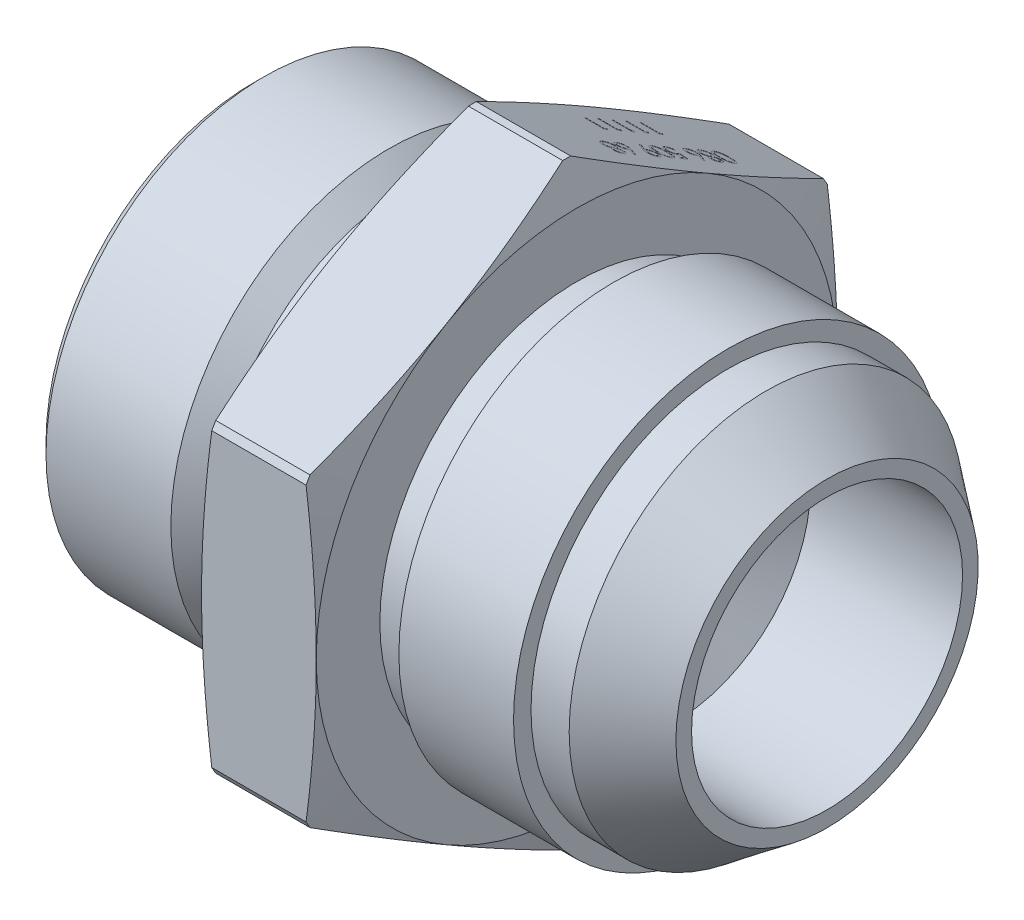
from build123d import *

# Parameters (mm, degrees)
SKETCH2_OUTSIDE_W  = 78.888
SKETCH2_OUTSIDE_H  = 78.888
EXTRUDE1_DEPTH     = 11
CUT_EXTRUDE1_DEPTH = 0.01


with BuildPart() as part:
    # Sketch1 → Revolve1 (revolve)
    with BuildSketch(Plane.XY, mode=Mode.PRIVATE) as revolve1_sk:
        with BuildLine():
            Line((0, 18.4), (0, 19.925))
            Line((0, 19.925), (1, 20.925))
            Line((1, 20.925), (12.975, 20.925))
            Line((12.975, 20.925), (15, 18.9))
            Line((15, 18.9), (19.2, 18.9))
            ThreePointArc((19.2, 18.9), (19.765685425, 19.134314575), (20, 19.7))
            Line((20, 19.7), (20, 25))
            Line((20, 25), (20.978014552, 28.65))
            Line((20.978014552, 28.65), (30.021985448, 28.65))
            Line((30.021985448, 28.65), (31, 25))
            Line((31, 25), (31, 18.9))
            Line((31, 18.9), (34.5, 18.9))
            Line((34.5, 18.9), (34.5, 20.575))
            Line((34.5, 20.575), (45.5, 20.575))
            Line((45.5, 20.575), (45.5, 18.9))
            Line((45.5, 18.9), (49.161002785, 18.9))
            Line((49.161002785, 18.9), (55, 14.5))
            Line((55, 14.5), (55, 13))
            Line((55, 13), (40.4, 13))
            Line((40.4, 13), (35.593115048, 5))
            Line((35.593115048, 5), (16.00860619, 5))
            Line((16.00860619, 5), (10, 15))
            Line((10, 15), (6, 15))
            Line((6, 15), (0, 18.4))
        make_face()
    revolve(revolve1_sk.sketch.rotate(Axis((0, 0, 0), (1, 0, 0)), 90), axis=Axis((0, 0, 0), (1, 0, 0)))

    # Sketch2 outside → Extrude1 (cut)
    with BuildSketch(Plane(origin=(31, 0, 0), x_dir=(0, 0, -1), z_dir=(1, 0, 0))):
        Rectangle(SKETCH2_OUTSIDE_W, SKETCH2_OUTSIDE_H)
        Polygon((25, -14.43375673), (25, 14.43375673), (0, 28.867513459), (-25, 14.43375673), (-25, -14.43375673), (0, -28.867513459), align=None, mode=Mode.SUBTRACT)
    extrude(amount=-EXTRUDE1_DEPTH, mode=Mode.SUBTRACT)

    # Sketch4 → Cut-Extrude1 (cut)
    # profile 1 of 13: a face of its own
    with BuildSketch(Plane(origin=(0, 21.650635095, -12.5), x_dir=(1, 0, 0), z_dir=(0, 0.8660254037844385, -0.5000000000000001))):
        with BuildLine():
            add(Edge.make_bspline(
                [(27.599198718, 6.492140653), (27.631254368, 6.491953214), (27.693522931, 6.491589111), (27.784257012, 6.487538585), (27.869377177, 6.480809818), (27.948887499, 6.471588461), (28.022808512, 6.460366763), (28.090942644, 6.445386468), (28.153605327, 6.428350637), (28.211000613, 6.408606196), (28.263902743, 6.386328099), (28.313286509, 6.362077694), (28.359089215, 6.334905811), (28.40199894, 6.306318976), (28.441536791, 6.27527255), (28.477627893, 6.242093996), (28.510294038, 6.206454196), (28.539924009, 6.169058024), (28.565735491, 6.129669148), (28.588993352, 6.089501794), (28.608082501, 6.047847177), (28.623767655, 6.0050852), (28.636335772, 5.96134022), (28.645039168, 5.916431486), (28.650493858, 5.870348149), (28.651016827, 5.839244821), (28.651282051, 5.823470781)],
                knots=[0, 0, 0, 0, 1.646377244, 3.198111528, 4.663803227, 6.031090796, 7.308794487, 8.502186765, 9.612154809, 10.642545331, 11.617106989, 12.558866172, 13.465886467, 14.35053239, 15.20542558, 16.045215227, 16.865619885, 17.686225247, 18.492864914, 19.282407821, 20.068097601, 20.842842034, 21.620163247, 22.403093475, 23.190129512, 24, 24, 24, 24], degree=3))
            add(Edge.make_bspline(
                [(28.651282051, 5.823470781), (28.6510033, 5.807564794), (28.650448951, 5.775932789), (28.645120984, 5.72916686), (28.636280342, 5.683481328), (28.623754071, 5.639070963), (28.608213684, 5.59557097), (28.588735331, 5.553321594), (28.566061693, 5.512060405), (28.539419477, 5.472443098), (28.509715319, 5.434034746), (28.476136651, 5.397778767), (28.439022526, 5.363671861), (28.398770032, 5.331285972), (28.354607127, 5.301539917), (28.307301921, 5.273212241), (28.256027141, 5.247856792), (28.201638303, 5.223436978), (28.142630498, 5.2023587), (28.079336349, 5.183349417), (28.011008242, 5.167990006), (27.938004673, 5.155196136), (27.86005754, 5.145284767), (27.777333931, 5.138066114), (27.689779422, 5.134252923), (27.629917794, 5.133534808), (27.599198718, 5.133166294)],
                knots=[0, 0, 0, 0, 0.810914788, 1.612654377, 2.396697861, 3.181598691, 3.963628158, 4.749916497, 5.551656086, 6.361998678, 7.18212741, 8.025565596, 8.878627764, 9.750805457, 10.657531673, 11.591944965, 12.560506719, 13.57287815, 14.630710178, 15.753379473, 16.941251878, 18.199788006, 19.531962791, 20.947069417, 22.433333509, 24, 24, 24, 24], degree=3))
            add(Edge.make_bspline(
                [(27.599198718, 5.133166294), (27.568613742, 5.133539088), (27.509020164, 5.134265463), (27.421858027, 5.138018366), (27.339578981, 5.145445635), (27.261953994, 5.154631994), (27.18944395, 5.167717836), (27.121359366, 5.182594133), (27.058287801, 5.201083773), (26.999591198, 5.221874753), (26.945468829, 5.245764682), (26.894637296, 5.271344226), (26.847370689, 5.299498021), (26.803208426, 5.329421475), (26.762606838, 5.361532087), (26.725465582, 5.395783416), (26.691809154, 5.432201532), (26.661699145, 5.470696721), (26.635367063, 5.510937264), (26.611830418, 5.552060729), (26.592731889, 5.594887903), (26.576606632, 5.638466986), (26.564051543, 5.683209176), (26.555455159, 5.729070587), (26.549409477, 5.775901024), (26.548949256, 5.807559291), (26.548717949, 5.823470781)],
                knots=[0, 0, 0, 0, 1.56130642, 3.042141888, 4.451772327, 5.777565838, 7.030558081, 8.211376819, 9.333164717, 10.383253789, 11.387583522, 12.350962576, 13.286244149, 14.193812918, 15.072134482, 15.925989337, 16.770211267, 17.600669898, 18.417446232, 19.22325363, 20.01647746, 20.807971184, 21.593601364, 22.38506573, 23.188331689, 24, 24, 24, 24], degree=3))
            add(Edge.make_bspline(
                [(26.548717949, 5.823470781), (26.548985725, 5.839244181), (26.549513727, 5.870346245), (26.554931552, 5.916438838), (26.5637662, 5.961277533), (26.575763607, 6.004951963), (26.591011601, 6.047551511), (26.610406484, 6.088658871), (26.632901531, 6.12881693), (26.658493856, 6.167842446), (26.687821995, 6.204991616), (26.720258045, 6.240477283), (26.756615569, 6.273403447), (26.796312609, 6.304060762), (26.839012336, 6.33315289), (26.885135373, 6.360058508), (26.934981836, 6.384261612), (26.988176002, 6.407038979), (27.045993115, 6.427117186), (27.108990015, 6.444718881), (27.177515185, 6.459392356), (27.251365196, 6.471192841), (27.330595321, 6.480921154), (27.415345059, 6.487506724), (27.505541292, 6.491592337), (27.56740988, 6.491954546), (27.599198718, 6.492140653)],
                knots=[0, 0, 0, 0, 0.810940842, 1.599017053, 2.38298203, 3.159479784, 3.926441347, 4.70693857, 5.494146311, 6.292334103, 7.104379492, 7.925868426, 8.762126819, 9.623561095, 10.503686106, 11.41783325, 12.366995289, 13.351843594, 14.392337808, 15.512229747, 16.713911458, 17.994391108, 19.357476964, 20.818259213, 22.365182633, 24, 24, 24, 24], degree=3))
        make_face()
        with BuildLine():
            add(Edge.make_bspline(
                [(27.6, 6.312653474), (27.573286458, 6.312585218), (27.521440718, 6.312452748), (27.446101712, 6.308992062), (27.375832952, 6.304277644), (27.310545218, 6.298196901), (27.250459492, 6.28916665), (27.195162546, 6.279048468), (27.14494693, 6.266735332), (27.099468354, 6.252166558), (27.057954011, 6.235573445), (27.019326804, 6.217453515), (26.983118411, 6.197998363), (26.949696589, 6.176187074), (26.918728647, 6.152514377), (26.89030358, 6.126941397), (26.864545412, 6.099513112), (26.833980849, 6.061543373), (26.802022844, 6.011663105), (26.77453652, 5.948493485), (26.757151332, 5.88355555), (26.754946603, 5.839467085), (26.753846154, 5.817461166)],
                knots=[0, 0, 0, 0, 1.459116078, 2.831857795, 4.118796693, 5.306371758, 6.412361096, 7.436813035, 8.376339383, 9.234574298, 10.043323891, 10.816788787, 11.564361537, 12.286735248, 12.994408768, 13.691741332, 14.372975427, 15.047457468, 16.352811911, 17.594285292, 18.799233213, 20, 20, 20, 20], degree=3))
            add(Edge.make_bspline(
                [(26.753846154, 5.817461166), (26.754759171, 5.795313925), (26.756583322, 5.751065169), (26.7741826, 5.686417286), (26.800736623, 5.623657132), (26.832135197, 5.574473166), (26.8620371, 5.53705457), (26.887531184, 5.510244861), (26.916077394, 5.485637976), (26.946876992, 5.462299648), (26.980518412, 5.440894462), (27.016839883, 5.421429811), (27.055942271, 5.403667899), (27.083239264, 5.393548444), (27.097195513, 5.388374628)],
                knots=[0, 0, 0, 0, 1.353760809, 2.704726607, 4.075137775, 5.516104923, 6.260822281, 7.007110065, 7.778089737, 8.566572457, 9.372053459, 10.217411131, 11.088608312, 12, 12, 12, 12], degree=3))
            add(Edge.make_bspline(
                [(27.097195513, 5.388374628), (27.115041078, 5.382345046), (27.151275229, 5.370102409), (27.20748303, 5.354324253), (27.266456038, 5.34189831), (27.327841819, 5.330719244), (27.392093077, 5.323088927), (27.459011011, 5.316947319), (27.528646075, 5.313329784), (27.575957498, 5.312881354), (27.6, 5.312653474)],
                knots=[0, 0, 0, 0, 0.884706709, 1.796334032, 2.740027952, 3.714592787, 4.726048262, 5.777819803, 6.87074269, 8, 8, 8, 8], degree=3))
            add(Edge.make_bspline(
                [(27.6, 5.312653474), (27.624041985, 5.312904802), (27.671079064, 5.313396514), (27.739894354, 5.316627107), (27.805368264, 5.321818402), (27.867560189, 5.328844706), (27.926359436, 5.338490335), (27.981850144, 5.350073775), (28.034017354, 5.36365403), (28.082995602, 5.379230987), (28.128608845, 5.396786002), (28.170956394, 5.41617903), (28.21026275, 5.436874018), (28.246415087, 5.459356091), (28.279576591, 5.483353425), (28.309082061, 5.509500647), (28.335846046, 5.536760275), (28.366396084, 5.574941528), (28.397545625, 5.624926835), (28.426211773, 5.687124348), (28.442673655, 5.751850431), (28.444994619, 5.79560669), (28.446153846, 5.817461166)],
                knots=[0, 0, 0, 0, 1.313668642, 2.570134578, 3.763346207, 4.902004944, 5.98888779, 7.017888835, 7.998425394, 8.933058446, 9.82474457, 10.667209444, 11.476765193, 12.250262638, 12.991704352, 13.7104269, 14.401925311, 15.076585796, 16.378385137, 17.609787933, 18.806186071, 20, 20, 20, 20], degree=3))
            add(Edge.make_bspline(
                [(28.446153846, 5.817461166), (28.444994515, 5.839582433), (28.442673741, 5.883865267), (28.426254941, 5.949250028), (28.397812513, 6.011890604), (28.366194931, 6.061474883), (28.336386868, 6.099607963), (28.310465662, 6.126535241), (28.281954605, 6.151709443), (28.251117774, 6.175401863), (28.217679095, 6.197192155), (28.181475967, 6.216655269), (28.142845171, 6.234764798), (28.101340273, 6.251393535), (28.055793136, 6.265827295), (28.005830952, 6.278728414), (27.950482357, 6.288840457), (27.890228647, 6.297664655), (27.824860654, 6.304392605), (27.754429892, 6.308979959), (27.678960601, 6.312459009), (27.626847358, 6.312587354), (27.6, 6.312653474)],
                knots=[0, 0, 0, 0, 1.207964612, 2.418129846, 3.655795183, 4.951004962, 5.620895151, 6.296795572, 6.989224116, 7.696855977, 8.419187164, 9.166715907, 9.940135271, 10.748837255, 11.607021648, 12.548275234, 13.5654991, 14.678641405, 15.874140913, 17.15372626, 18.533675393, 20, 20, 20, 20], degree=3))
        make_face(mode=Mode.SUBTRACT)
    # profile 2 of 13: a face of its own
    with BuildSketch(Plane(origin=(0, 21.650635095, -12.5), x_dir=(1, 0, 0), z_dir=(0, 0.8660254037844385, -0.5000000000000001))):
        with BuildLine():
            add(Edge.make_bspline(
                [(27.714182692, 3.981323346), (27.705636282, 3.965091147), (27.688915789, 3.933333912), (27.662079484, 3.887895332), (27.634045445, 3.84606079), (27.605693685, 3.80723409), (27.575903542, 3.772207165), (27.545015052, 3.740748242), (27.513855619, 3.711870371), (27.481206025, 3.687091769), (27.447739677, 3.665241603), (27.413168899, 3.646383667), (27.377602733, 3.630257922), (27.340644158, 3.617479533), (27.3028384, 3.606952677), (27.263696667, 3.599709506), (27.223477052, 3.595814116), (27.196295164, 3.595077652), (27.182532051, 3.594704756)],
                knots=[0, 0, 0, 0, 1.264385854, 2.473688339, 3.635349404, 4.734491366, 5.785876313, 6.801388178, 7.772322209, 8.711311751, 9.622826105, 10.524996139, 11.423212571, 12.31118177, 13.217849097, 14.126010572, 15.051135535, 16, 16, 16, 16], degree=3))
            add(Edge.make_bspline(
                [(27.182532051, 3.594704756), (27.163274882, 3.595141646), (27.125157718, 3.596006417), (27.068922021, 3.603663416), (27.014175758, 3.614838648), (26.961448205, 3.632240899), (26.910078621, 3.653026805), (26.861006258, 3.679766656), (26.81285893, 3.709774594), (26.783250853, 3.733926335), (26.768269231, 3.746147063)],
                knots=[0, 0, 0, 0, 1.02534174, 2.029536028, 3.018826961, 3.997522084, 4.983122576, 5.966563916, 6.971085759, 8, 8, 8, 8], degree=3))
            add(Edge.make_bspline(
                [(26.768269231, 3.746147063), (26.750787074, 3.76205362), (26.716038793, 3.793670172), (26.670924044, 3.847831845), (26.633010105, 3.907272921), (26.602111879, 3.971763397), (26.578062817, 4.041130884), (26.560781378, 4.115360601), (26.550882847, 4.194597259), (26.549451996, 4.249057529), (26.548717949, 4.276996422)],
                knots=[0, 0, 0, 0, 0.954267603, 1.896743057, 2.838368354, 3.796610408, 4.779680527, 5.799409237, 6.871065594, 8, 8, 8, 8], degree=3))
            add(Edge.make_bspline(
                [(26.548717949, 4.276996422), (26.549378275, 4.303860597), (26.550663202, 4.356135553), (26.559321404, 4.432234286), (26.574649728, 4.503256381), (26.595195854, 4.569538553), (26.622594577, 4.630439935), (26.656177494, 4.686071038), (26.695186057, 4.737248041), (26.740560382, 4.782362494), (26.789166236, 4.822412458), (26.839309667, 4.85759435), (26.890997388, 4.886836643), (26.943458147, 4.911594993), (26.997427384, 4.930548146), (27.05262739, 4.943675124), (27.108961757, 4.952011875), (27.146979845, 4.953121095), (27.166105769, 4.953679115)],
                knots=[0, 0, 0, 0, 1.256882982, 2.445766618, 3.576898315, 4.651879663, 5.686612882, 6.692806257, 7.686348993, 8.689277895, 9.678883454, 10.630458183, 11.551151498, 12.454054546, 13.341321255, 14.221808008, 15.105437234, 16, 16, 16, 16], degree=3))
            add(Edge.make_bspline(
                [(27.166105769, 4.953679115), (27.180139604, 4.953348913), (27.207875415, 4.952696318), (27.24885202, 4.948179031), (27.288736095, 4.940917907), (27.327671557, 4.931052203), (27.365387519, 4.917697604), (27.40201577, 4.901515531), (27.437837733, 4.882829703), (27.472237589, 4.860432693), (27.50636177, 4.835774674), (27.538543512, 4.806524659), (27.570575596, 4.77444425), (27.601071996, 4.738223642), (27.631498489, 4.698971458), (27.659918782, 4.655497995), (27.688412304, 4.609024658), (27.705445175, 4.575992521), (27.714182692, 4.559047704)],
                knots=[0, 0, 0, 0, 0.941717298, 1.86116577, 2.762973304, 3.660719123, 4.553575492, 5.444450535, 6.34648071, 7.261375261, 8.197060099, 9.168336537, 10.175980388, 11.237504102, 12.343496232, 13.506792996, 14.721035322, 16, 16, 16, 16], degree=3))
            add(Edge.make_bspline(
                [(27.714182692, 4.559047704), (27.726829161, 4.582245178), (27.751316264, 4.627161981), (27.79634113, 4.686597688), (27.844927465, 4.737732453), (27.898681063, 4.778584587), (27.955234414, 4.81100109), (28.014406292, 4.833892505), (28.07548817, 4.848840883), (28.117141606, 4.850354726), (28.138060897, 4.851115012)],
                knots=[0, 0, 0, 0, 1.16709546, 2.25982348, 3.287408737, 4.277418348, 5.234967981, 6.16072867, 7.076276605, 8, 8, 8, 8], degree=3))
            add(Edge.make_bspline(
                [(28.138060897, 4.851115012), (28.159373765, 4.850180466), (28.202216347, 4.848301865), (28.265991622, 4.833111675), (28.328628264, 4.808356233), (28.389831339, 4.774691517), (28.447495858, 4.732738893), (28.499388962, 4.682417141), (28.544452837, 4.624587296), (28.582524276, 4.56027613), (28.61366436, 4.491202728), (28.634921789, 4.418198326), (28.648903193, 4.342567538), (28.650481694, 4.291082143), (28.651282051, 4.264977192)],
                knots=[0, 0, 0, 0, 0.888753872, 1.786550278, 2.720173491, 3.693036334, 4.694165094, 5.687489879, 6.699912706, 7.744713188, 8.800178723, 9.852977058, 10.911381959, 12, 12, 12, 12], degree=3))
            add(Edge.make_bspline(
                [(28.651282051, 4.264977192), (28.65045911, 4.239545523), (28.648836362, 4.18939717), (28.635169495, 4.115573602), (28.612597078, 4.044880028), (28.581861931, 3.977702203), (28.543534279, 3.915507944), (28.498015789, 3.859978097), (28.446305023, 3.811268069), (28.388796676, 3.770797389), (28.327595084, 3.738137196), (28.263944305, 3.714878149), (28.198697276, 3.700083499), (28.154563796, 3.69820835), (28.132451923, 3.697268858)],
                knots=[0, 0, 0, 0, 1.072712831, 2.115267497, 3.156282165, 4.197922255, 5.225560591, 6.230883479, 7.219814004, 8.214446311, 9.19021444, 10.138875805, 11.067534608, 12, 12, 12, 12], degree=3))
            add(Edge.make_bspline(
                [(28.132451923, 3.697268858), (28.110750844, 3.698088489), (28.068131157, 3.699698198), (28.006003552, 3.713242701), (27.947812681, 3.73604404), (27.892939831, 3.767207341), (27.842144198, 3.807760661), (27.795594668, 3.857634528), (27.751440783, 3.91528115), (27.726879667, 3.958817197), (27.714182692, 3.981323346)],
                knots=[0, 0, 0, 0, 0.975287281, 1.915408787, 2.843441052, 3.776938647, 4.743139116, 5.754296123, 6.83907365, 8, 8, 8, 8], degree=3))
        make_face()
        with BuildLine():
            add(Edge.make_bspline(
                [(28.446153846, 4.274993217), (28.445781594, 4.289022249), (28.445053307, 4.31646917), (28.441248372, 4.356714125), (28.433846534, 4.394984049), (28.423995841, 4.431678792), (28.41068842, 4.466295256), (28.395034129, 4.499303573), (28.376002091, 4.530141967), (28.354652835, 4.559182712), (28.331171175, 4.585326012), (28.306706192, 4.608528613), (28.280777397, 4.627801821), (28.254029763, 4.644168169), (28.225669433, 4.656043322), (28.196565904, 4.66493721), (28.166351399, 4.670949434), (28.145701964, 4.671399942), (28.13525641, 4.671627833)],
                knots=[0, 0, 0, 0, 1.203892937, 2.355340988, 3.463153438, 4.544400666, 5.610487187, 6.640501085, 7.674077295, 8.714426146, 9.728707835, 10.68524104, 11.601827946, 12.495867327, 13.368432065, 14.231010473, 15.105153427, 16, 16, 16, 16], degree=3))
            add(Edge.make_bspline(
                [(28.13525641, 4.671627833), (28.124815111, 4.671221487), (28.104181604, 4.67041849), (28.073589551, 4.664606372), (28.043918206, 4.654888461), (28.014890581, 4.641563115), (27.986581183, 4.624462529), (27.958881533, 4.603707523), (27.932524126, 4.578397545), (27.906761151, 4.550447691), (27.883025341, 4.519917421), (27.861823216, 4.487835661), (27.844921069, 4.453968276), (27.83010134, 4.419329517), (27.818984825, 4.383186853), (27.810976031, 4.345789493), (27.806022092, 4.307177385), (27.805428525, 4.281017497), (27.805128205, 4.267781679)],
                knots=[0, 0, 0, 0, 0.873213166, 1.72559466, 2.594724523, 3.479581045, 4.391597569, 5.35687048, 6.368548091, 7.443976143, 8.534559525, 9.600545123, 10.654815915, 11.696401765, 12.749428718, 13.812189468, 14.893058657, 16, 16, 16, 16], degree=3))
            add(Edge.make_bspline(
                [(27.805128205, 4.267781679), (27.805626986, 4.25078162), (27.806619622, 4.216949409), (27.815848865, 4.167075506), (27.830366532, 4.118582566), (27.85022937, 4.071988906), (27.875159575, 4.028500572), (27.905007014, 3.989734819), (27.939082498, 3.956022308), (27.976855547, 3.927713388), (28.017056455, 3.905764905), (28.057399479, 3.888678157), (28.09831504, 3.87870032), (28.125724734, 3.877398853), (28.139262821, 3.876756038)],
                knots=[0, 0, 0, 0, 1.076279235, 2.141928126, 3.20205304, 4.278698113, 5.344010996, 6.36967002, 7.368914609, 8.37248503, 9.349703398, 10.264243087, 11.142681841, 12, 12, 12, 12], degree=3))
            add(Edge.make_bspline(
                [(28.139262821, 3.876756038), (28.148765014, 3.877059193), (28.167625505, 3.877660914), (28.19546926, 3.88264393), (28.222711979, 3.890814428), (28.249360263, 3.902084131), (28.275788837, 3.916045289), (28.300881979, 3.934080536), (28.326036181, 3.954553586), (28.350136692, 3.978336519), (28.372830255, 4.005147852), (28.392352555, 4.035410861), (28.409307358, 4.068355748), (28.422930774, 4.104251288), (28.433191336, 4.142957415), (28.440867002, 4.184326288), (28.445195137, 4.22869411), (28.445827345, 4.259225458), (28.446153846, 4.274993217)],
                knots=[0, 0, 0, 0, 0.814272661, 1.61621452, 2.416847352, 3.248328223, 4.093649164, 4.973549185, 5.892801723, 6.872536627, 7.872406081, 8.898230315, 9.953166191, 11.044090313, 12.18293744, 13.382234284, 14.648068262, 16, 16, 16, 16], degree=3))
        make_face(mode=Mode.SUBTRACT)
        with BuildLine():
            add(Edge.make_bspline(
                [(27.6, 4.263374628), (27.599683753, 4.281160854), (27.599063352, 4.316053092), (27.59215338, 4.367170435), (27.582542722, 4.416232667), (27.56793146, 4.463055048), (27.549089738, 4.507580176), (27.526037376, 4.549908351), (27.499195146, 4.590099468), (27.468416398, 4.627494992), (27.435082235, 4.66156621), (27.40024442, 4.691983253), (27.363652729, 4.717302021), (27.32563357, 4.737990749), (27.286234307, 4.754016879), (27.245462851, 4.765850395), (27.203197341, 4.772719578), (27.174543321, 4.773698413), (27.160096154, 4.774191935)],
                knots=[0, 0, 0, 0, 1.140506561, 2.237395584, 3.304560074, 4.345354409, 5.3782877, 6.402081073, 7.433555996, 8.474808822, 9.504965884, 10.489266388, 11.437701257, 12.354123303, 13.261162422, 14.161620169, 15.073101032, 16, 16, 16, 16], degree=3))
            add(Edge.make_bspline(
                [(27.160096154, 4.774191935), (27.142134486, 4.773415079), (27.106498958, 4.771873816), (27.053851407, 4.759580983), (27.002739643, 4.740005419), (26.954062989, 4.712028997), (26.908427818, 4.678111849), (26.868192441, 4.636677623), (26.833213448, 4.589345922), (26.804532495, 4.5356446), (26.781525925, 4.477065583), (26.765871788, 4.41345705), (26.75543051, 4.345717043), (26.754382595, 4.298939337), (26.753846154, 4.274993217)],
                knots=[0, 0, 0, 0, 0.898956152, 1.783507998, 2.694187257, 3.631865312, 4.587204618, 5.533364321, 6.51415483, 7.525942309, 8.574485006, 9.65837228, 10.801290154, 12, 12, 12, 12], degree=3))
            add(Edge.make_bspline(
                [(26.753846154, 4.274993217), (26.754205066, 4.25627856), (26.754904342, 4.219816407), (26.761089575, 4.166626668), (26.770869291, 4.116421834), (26.785229556, 4.069226538), (26.802434023, 4.024475209), (26.824933824, 3.983168569), (26.850379239, 3.944206411), (26.880580741, 3.90941774), (26.91287956, 3.877780077), (26.946896071, 3.850069545), (26.982283839, 3.826617523), (27.019023622, 3.807713036), (27.056980028, 3.792701043), (27.096308965, 3.781879112), (27.137164889, 3.775209249), (27.164878439, 3.774534143), (27.178926282, 3.774191935)],
                knots=[0, 0, 0, 0, 1.22469164, 2.386092043, 3.500511288, 4.568136916, 5.611981868, 6.63276519, 7.641422348, 8.65223666, 9.641383647, 10.598487484, 11.519869765, 12.415254456, 13.298392158, 14.187051141, 15.081026348, 16, 16, 16, 16], degree=3))
            add(Edge.make_bspline(
                [(27.178926282, 3.774191935), (27.192572006, 3.774706171), (27.219478991, 3.775720154), (27.259323391, 3.782247459), (27.297974179, 3.793454912), (27.335265037, 3.80978917), (27.371599002, 3.829878169), (27.406707621, 3.854520007), (27.44031247, 3.884003352), (27.472448598, 3.917398025), (27.502174216, 3.953770157), (27.528467565, 3.992438258), (27.550611794, 4.033097644), (27.568621177, 4.075664133), (27.582785457, 4.120042714), (27.592680308, 4.166200879), (27.598908653, 4.214192634), (27.599632108, 4.246795418), (27.6, 4.263374628)],
                knots=[0, 0, 0, 0, 0.917481483, 1.809113215, 2.707052678, 3.61610275, 4.54058801, 5.494688304, 6.493986409, 7.541809048, 8.607637092, 9.648666143, 10.681335566, 11.715370464, 12.751897579, 13.808646822, 14.885650252, 16, 16, 16, 16], degree=3))
        make_face(mode=Mode.SUBTRACT)
    # profile 3 of 13: a face of its own
    with BuildSketch(Plane(origin=(0, 21.650635095, -12.5), x_dir=(1, 0, 0), z_dir=(0, 0.8660254037844385, -0.5000000000000001))):
        with BuildLine():
            Line((28.651282051, 2.492140653), (28.542708333, 2.353518858))
            Line((28.542708333, 2.353518858), (27.734615385, 2.881964371))
            add(Edge.make_bspline(
                [(27.734615385, 2.881964371), (27.740223305, 2.846781356), (27.751162188, 2.778152906), (27.752966728, 2.708686678), (27.753846154, 2.674832961)],
                knots=[0, 0, 0, 0, 1.025318673, 2, 2, 2, 2], degree=3))
            add(Edge.make_bspline(
                [(27.753846154, 2.674832961), (27.753307717, 2.654504797), (27.752251326, 2.614621763), (27.743902995, 2.55601923), (27.730908864, 2.499695005), (27.711891162, 2.445774741), (27.68760543, 2.394190005), (27.658497144, 2.344645826), (27.623065425, 2.298073236), (27.583485423, 2.253872566), (27.539647154, 2.213742795), (27.493132102, 2.178213621), (27.443988742, 2.14836974), (27.392241961, 2.12415607), (27.337971527, 2.105353282), (27.281246876, 2.091646057), (27.222028893, 2.083543432), (27.18175565, 2.082443152), (27.161298077, 2.081884243)],
                knots=[0, 0, 0, 0, 1.044136307, 2.048553127, 3.035567123, 4.010001674, 4.980053131, 5.96154148, 6.956538004, 7.981742224, 9.006487041, 10.005615874, 10.984750588, 11.954802044, 12.935714515, 13.930994945, 14.949008866, 16, 16, 16, 16], degree=3))
            add(Edge.make_bspline(
                [(27.161298077, 2.081884243), (27.133326313, 2.082927974), (27.078316954, 2.084980578), (26.997861289, 2.099922663), (26.921828095, 2.125709363), (26.849918575, 2.160208876), (26.784224941, 2.204969281), (26.724855512, 2.258012822), (26.673106333, 2.319840909), (26.628712868, 2.388989439), (26.593442315, 2.463829623), (26.567366076, 2.542302003), (26.551784861, 2.623735841), (26.549744955, 2.679040622), (26.548717949, 2.706884243)],
                knots=[0, 0, 0, 0, 1.031881447, 2.029301251, 3.006342947, 3.987068354, 4.962916383, 5.929513747, 6.915671209, 7.928552063, 8.953527267, 9.960179832, 10.973036711, 12, 12, 12, 12], degree=3))
            add(Edge.make_bspline(
                [(26.548717949, 2.706884243), (26.549591207, 2.733796649), (26.551320979, 2.787105412), (26.566730118, 2.865524076), (26.591705483, 2.940874659), (26.626114102, 3.012627509), (26.66957404, 3.079100454), (26.721901645, 3.138551699), (26.781940416, 3.190774399), (26.84987453, 3.234005556), (26.922404052, 3.269239065), (26.998720863, 3.294089769), (27.077289059, 3.310160785), (27.130771351, 3.311818861), (27.157692308, 3.312653474)],
                knots=[0, 0, 0, 0, 1.011913813, 2.004424092, 2.994488568, 3.992479987, 4.990471406, 5.973328987, 6.963763268, 7.974390938, 8.994854117, 9.989689954, 10.988086187, 12, 12, 12, 12], degree=3))
            add(Edge.make_bspline(
                [(27.157692308, 3.312653474), (27.178281713, 3.311928646), (27.220302637, 3.310449345), (27.284128603, 3.301621048), (27.349180353, 3.285428872), (27.404326441, 3.267905399), (27.449997393, 3.250516824), (27.486062537, 3.234393736), (27.524148487, 3.216366161), (27.56353462, 3.195235331), (27.605346282, 3.172834946), (27.64803506, 3.146668755), (27.693160081, 3.119363933), (27.723203618, 3.099361116), (27.738621795, 3.089095781)],
                knots=[0, 0, 0, 0, 1.17367173, 2.395347028, 3.66355231, 4.98980831, 5.690886799, 6.447442954, 7.240630024, 8.091733897, 8.994365608, 9.943299771, 10.944512865, 12, 12, 12, 12], degree=3))
            Line((27.738621795, 3.089095781), (28.651282051, 2.492140653))
        make_face()
        with BuildLine():
            add(Edge.make_bspline(
                [(27.548717949, 2.712493217), (27.548267462, 2.727728307), (27.547383611, 2.757619427), (27.542391632, 2.801418716), (27.532933143, 2.842759911), (27.520698551, 2.882115487), (27.504039631, 2.919074209), (27.484046591, 2.954061532), (27.460267289, 2.986715938), (27.433007407, 3.016517667), (27.403417734, 3.043782684), (27.371967191, 3.067784887), (27.338783247, 3.088018862), (27.304151414, 3.10455082), (27.26789071, 3.117394755), (27.230201222, 3.126692947), (27.190821211, 3.131865967), (27.16411698, 3.132726747), (27.150480769, 3.133166294)],
                knots=[0, 0, 0, 0, 1.129054775, 2.21519617, 3.259426851, 4.267013074, 5.263608451, 6.256463875, 7.247987236, 8.249677815, 9.244060445, 10.225610515, 11.175892485, 12.118571871, 13.063688666, 14.021206195, 14.989551517, 16, 16, 16, 16], degree=3))
            add(Edge.make_bspline(
                [(27.150480769, 3.133166294), (27.136967009, 3.132807451), (27.110468538, 3.132103813), (27.071410238, 3.12574422), (27.033857824, 3.115960524), (26.997783831, 3.101639786), (26.963385037, 3.083677394), (26.930417097, 3.061572689), (26.898857255, 3.035699958), (26.86950134, 3.005623422), (26.842575381, 2.973188794), (26.818600456, 2.938887026), (26.798467931, 2.902827185), (26.782551583, 2.86480351), (26.769515714, 2.825348362), (26.760335915, 2.784160752), (26.755147533, 2.741204489), (26.75428564, 2.712106286), (26.753846154, 2.697268858)],
                knots=[0, 0, 0, 0, 0.989642335, 1.94054129, 2.892446913, 3.828371744, 4.778262963, 5.730973156, 6.732161388, 7.763274768, 8.805796303, 9.818398792, 10.825975928, 11.825728216, 12.834635236, 13.867465554, 14.912602056, 16, 16, 16, 16], degree=3))
            add(Edge.make_bspline(
                [(26.753846154, 2.697268858), (26.754285606, 2.682431406), (26.755147431, 2.653333156), (26.760336303, 2.610377239), (26.769514291, 2.569188351), (26.782556741, 2.529737845), (26.798448796, 2.491697033), (26.81872661, 2.455605627), (26.842429612, 2.420976369), (26.869547683, 2.388563018), (26.898691381, 2.358360771), (26.930702849, 2.333094036), (26.963123012, 2.310290993), (26.997920908, 2.293018486), (27.033836108, 2.27853826), (27.071416055, 2.268803927), (27.110467015, 2.262431173), (27.136966495, 2.261729343), (27.150480769, 2.261371422)],
                knots=[0, 0, 0, 0, 1.087205562, 2.132157158, 3.164804748, 4.173533273, 5.173108684, 6.180507559, 7.20098426, 8.243321352, 9.274252308, 10.269075238, 11.227079059, 12.172305571, 13.108064818, 14.05980203, 15.010532752, 16, 16, 16, 16], degree=3))
            add(Edge.make_bspline(
                [(27.150480769, 2.261371422), (27.164136383, 2.261682211), (27.190937912, 2.262292186), (27.230165397, 2.269324953), (27.268198475, 2.278823875), (27.304180391, 2.294175003), (27.339106188, 2.312459451), (27.371977661, 2.335752635), (27.403726066, 2.362458841), (27.433182618, 2.393387219), (27.460125977, 2.427034525), (27.483908009, 2.462815984), (27.503979566, 2.500248816), (27.520726476, 2.539296861), (27.532811768, 2.580407062), (27.542328413, 2.622915818), (27.547375326, 2.667234049), (27.548265993, 2.697258001), (27.548717949, 2.712493217)],
                knots=[0, 0, 0, 0, 0.978850575, 1.921165339, 2.853482305, 3.786193361, 4.721019802, 5.678231452, 6.671107257, 7.694736563, 8.738100728, 9.761595396, 10.773671158, 11.783065439, 12.804898115, 13.84455739, 14.906252091, 16, 16, 16, 16], degree=3))
        make_face(mode=Mode.SUBTRACT)
    # profile 4 of 13: a face of its own
    with BuildSketch(Plane(origin=(0, 21.650635095, -12.5), x_dir=(1, 0, 0), z_dir=(0, 0.8660254037844385, -0.5000000000000001))):
        with BuildLine():
            Line((28.6, -0.148884988), (28.394871795, -0.148884988))
            Line((28.394871795, -0.148884988), (28.394871795, 0.531002833))
            Line((28.394871795, 0.531002833), (27.868830128, 0.63917591))
            add(Edge.make_bspline(
                [(27.868830128, 0.63917591), (27.874675998, 0.618001124), (27.886001446, 0.576978327), (27.898576172, 0.516429835), (27.906156425, 0.458948576), (27.90719146, 0.421648364), (27.907692308, 0.403598987)],
                knots=[0, 0, 0, 0, 1.100273476, 2.13160584, 3.095893838, 4, 4, 4, 4], degree=3))
            add(Edge.make_bspline(
                [(27.907692308, 0.403598987), (27.907208789, 0.381265498), (27.906258071, 0.33735228), (27.897133098, 0.273100358), (27.882760904, 0.211771253), (27.862715732, 0.153469749), (27.836917863, 0.098070271), (27.80510963, 0.045882194), (27.767511048, -0.00339025), (27.724484879, -0.049095698), (27.6770729, -0.090495368), (27.626262069, -0.127038986), (27.572006169, -0.157431483), (27.514545116, -0.182435846), (27.453975323, -0.202274393), (27.389848453, -0.215514728), (27.322733573, -0.224321338), (27.276845479, -0.225305967), (27.253445513, -0.225808065)],
                knots=[0, 0, 0, 0, 1.052772836, 2.070014431, 3.053871312, 4.019926262, 4.972333346, 5.930471369, 6.896690565, 7.89035727, 8.885779078, 9.861050232, 10.836829716, 11.812751485, 12.812646763, 13.836748493, 14.896881366, 16, 16, 16, 16], degree=3))
            add(Edge.make_bspline(
                [(27.253445513, -0.225808065), (27.23714708, -0.225428073), (27.204770473, -0.224673225), (27.156688386, -0.220833281), (27.109622744, -0.213444235), (27.063574252, -0.203509519), (27.018604472, -0.190666093), (26.974729763, -0.174949348), (26.931815026, -0.156423181), (26.88985745, -0.135506698), (26.850150521, -0.111310205), (26.812081303, -0.085822023), (26.777050823, -0.057588133), (26.743780235, -0.02797548), (26.713576128, 0.004200024), (26.685145936, 0.037939704), (26.659724609, 0.074035345), (26.636342727, 0.111840701), (26.615407498, 0.151331932), (26.597943778, 0.192909472), (26.582636676, 0.235660585), (26.57018886, 0.279966307), (26.560531154, 0.325740804), (26.553954387, 0.373141704), (26.549169216, 0.421931158), (26.548869397, 0.455002526), (26.548717949, 0.471707961)],
                knots=[0, 0, 0, 0, 1.05623316, 2.098192244, 3.122504159, 4.140841222, 5.148757784, 6.150489607, 7.158294732, 8.176043417, 9.185147859, 10.169157858, 11.142149047, 12.097904048, 13.0527185, 13.998867679, 14.954465986, 15.910220987, 16.877849176, 17.847023716, 18.829548819, 19.818454515, 20.826519638, 21.858115382, 22.918063636, 24, 24, 24, 24], degree=3))
            add(Edge.make_bspline(
                [(26.548717949, 0.471707961), (26.549112748, 0.49163604), (26.549889469, 0.530842181), (26.558013824, 0.588282853), (26.569652148, 0.643547072), (26.587152029, 0.69619747), (26.609111831, 0.746678262), (26.636689505, 0.794317449), (26.668377508, 0.840051403), (26.705269181, 0.882637129), (26.745970299, 0.922081623), (26.789665413, 0.957933241), (26.836528262, 0.989374896), (26.886159885, 1.016534898), (26.938645682, 1.039668524), (26.994142709, 1.057850752), (27.052371784, 1.072523485), (27.092459435, 1.078731238), (27.112820513, 1.081884243)],
                knots=[0, 0, 0, 0, 1.046825758, 2.059506013, 3.044032586, 4.011925612, 4.970610144, 5.93275819, 6.900651216, 7.891265644, 8.889116719, 9.876966323, 10.858259055, 11.851035124, 12.847502422, 13.86866322, 14.9174643, 16, 16, 16, 16], degree=3))
            Line((27.112820513, 1.081884243), (27.112820513, 0.902397063))
            add(Edge.make_bspline(
                [(27.112820513, 0.902397063), (27.093746435, 0.897983524), (27.057084997, 0.889500457), (27.005605589, 0.870831613), (26.959557767, 0.848146226), (26.918898057, 0.820557169), (26.883255491, 0.788312258), (26.851218643, 0.751781543), (26.822699078, 0.710444597), (26.798773606, 0.664527772), (26.778398799, 0.616057075), (26.764824448, 0.565334574), (26.755281591, 0.513731667), (26.754326231, 0.478829798), (26.753846154, 0.461291294)],
                knots=[0, 0, 0, 0, 1.136389429, 2.184203582, 3.172920998, 4.111012962, 5.028380909, 5.957351669, 6.927793475, 7.937618031, 8.960409703, 9.974842029, 10.982339866, 12, 12, 12, 12], degree=3))
            add(Edge.make_bspline(
                [(26.753846154, 0.461291294), (26.75431517, 0.444172183), (26.755238666, 0.410464513), (26.762346673, 0.360858007), (26.773293857, 0.312964936), (26.789676631, 0.267257875), (26.809587898, 0.222936995), (26.83513937, 0.181123412), (26.864545095, 0.140607482), (26.898234598, 0.102648549), (26.935360138, 0.067883149), (26.975061506, 0.037165365), (27.017413989, 0.011578558), (27.061684362, -0.00998379), (27.108357824, -0.026357104), (27.157215638, -0.038037664), (27.208378484, -0.044896555), (27.243275232, -0.045840087), (27.261057692, -0.046320885)],
                knots=[0, 0, 0, 0, 1.027316725, 2.022795036, 3.002884548, 3.971462791, 4.93288096, 5.914575861, 6.907176829, 7.935150275, 8.956128384, 9.956726525, 10.942570165, 11.921478529, 12.907843606, 13.90538589, 14.932640048, 16, 16, 16, 16], degree=3))
            add(Edge.make_bspline(
                [(27.261057692, -0.046320885), (27.277110646, -0.046005217), (27.308550025, -0.045386986), (27.354343836, -0.038516931), (27.397988004, -0.028893048), (27.439092233, -0.014116804), (27.478258437, 0.004140499), (27.514648315, 0.027303404), (27.549196786, 0.053780991), (27.580500334, 0.084793569), (27.609587054, 0.118611467), (27.634346338, 0.156019713), (27.655185227, 0.196165054), (27.673166287, 0.238582848), (27.686081181, 0.28427683), (27.695777064, 0.332343547), (27.701385857, 0.383301646), (27.702164077, 0.418142042), (27.702564103, 0.43605091)],
                knots=[0, 0, 0, 0, 1.045726679, 2.048034203, 3.01323695, 3.95502507, 4.889743367, 5.8246644, 6.761650845, 7.722168973, 8.692072792, 9.66525385, 10.638902184, 11.638179751, 12.663148338, 13.728659964, 14.832472288, 16, 16, 16, 16], degree=3))
            add(Edge.make_bspline(
                [(27.702564103, 0.43605091), (27.702243602, 0.45168778), (27.701587488, 0.483698881), (27.696424006, 0.532915894), (27.688480486, 0.584410522), (27.677031339, 0.638382685), (27.662696218, 0.694684265), (27.644793449, 0.753408892), (27.624171717, 0.814557985), (27.6081768, 0.855715704), (27.6, 0.876756038)],
                knots=[0, 0, 0, 0, 0.824638674, 1.688163388, 2.607705698, 3.571998603, 4.597075385, 5.671199175, 6.809488238, 8, 8, 8, 8], degree=3))
            Line((27.6, 0.876756038), (28.6, 0.671627833))
            Line((28.6, 0.671627833), (28.6, -0.148884988))
        make_face()
    # profile 5 of 13: a face of its own
    with BuildSketch(Plane(origin=(0, 21.650635095, -12.5), x_dir=(1, 0, 0), z_dir=(0, 0.8660254037844385, -0.5000000000000001))):
        with BuildLine():
            add(Edge.make_bspline(
                [(27.599198718, -0.43093627), (27.631254368, -0.431123709), (27.693522931, -0.431487812), (27.784257012, -0.435538338), (27.869377177, -0.442267105), (27.948887499, -0.451488462), (28.022808512, -0.46271016), (28.090942644, -0.477690455), (28.153605327, -0.494726287), (28.211000613, -0.514470727), (28.263902743, -0.536748824), (28.313286509, -0.560999229), (28.359089215, -0.588171112), (28.40199894, -0.616757947), (28.441536791, -0.647804373), (28.477627893, -0.680982927), (28.510294038, -0.716622727), (28.539924009, -0.754018899), (28.565735491, -0.793407775), (28.588993352, -0.83357513), (28.608082501, -0.875229746), (28.623767655, -0.917991723), (28.636335772, -0.961736703), (28.645039168, -1.006645437), (28.650493858, -1.052728774), (28.651016827, -1.083832102), (28.651282051, -1.099606142)],
                knots=[0, 0, 0, 0, 1.646377244, 3.198111528, 4.663803227, 6.031090796, 7.308794487, 8.502186765, 9.612154809, 10.642545331, 11.617106989, 12.558866172, 13.465886467, 14.35053239, 15.20542558, 16.045215227, 16.865619885, 17.686225247, 18.492864914, 19.282407821, 20.068097601, 20.842842034, 21.620163247, 22.403093475, 23.190129512, 24, 24, 24, 24], degree=3))
            add(Edge.make_bspline(
                [(28.651282051, -1.099606142), (28.6510033, -1.115512129), (28.650448951, -1.147144134), (28.645120984, -1.193910063), (28.636280342, -1.239595596), (28.623754071, -1.284005961), (28.608213684, -1.327505953), (28.588735331, -1.369755329), (28.566061693, -1.411016518), (28.539419477, -1.450633825), (28.509715319, -1.489042177), (28.476136651, -1.525298156), (28.439022526, -1.559405062), (28.398770032, -1.591790951), (28.354607127, -1.621537006), (28.307301921, -1.649864682), (28.256027141, -1.675220131), (28.201638303, -1.699639945), (28.142630498, -1.720718223), (28.079336349, -1.739727506), (28.011008242, -1.755086917), (27.938004673, -1.767880787), (27.86005754, -1.777792156), (27.777333931, -1.785010809), (27.689779422, -1.788824), (27.629917794, -1.789542115), (27.599198718, -1.789910629)],
                knots=[0, 0, 0, 0, 0.810914788, 1.612654377, 2.396697861, 3.181598691, 3.963628158, 4.749916497, 5.551656086, 6.361998678, 7.18212741, 8.025565596, 8.878627764, 9.750805457, 10.657531673, 11.591944965, 12.560506719, 13.57287815, 14.630710178, 15.753379473, 16.941251878, 18.199788006, 19.531962791, 20.947069417, 22.433333509, 24, 24, 24, 24], degree=3))
            add(Edge.make_bspline(
                [(27.599198718, -1.789910629), (27.568613742, -1.789537835), (27.509020164, -1.78881146), (27.421858027, -1.785058557), (27.339578981, -1.777631288), (27.261953994, -1.768444929), (27.18944395, -1.755359087), (27.121359366, -1.74048279), (27.058287801, -1.72199315), (26.999591198, -1.70120217), (26.945468829, -1.677312241), (26.894637296, -1.651732697), (26.847370689, -1.623578903), (26.803208426, -1.593655448), (26.762606838, -1.561544836), (26.725465582, -1.527293507), (26.691809154, -1.490875391), (26.661699145, -1.452380202), (26.635367063, -1.412139659), (26.611830418, -1.371016194), (26.592731889, -1.32818902), (26.576606632, -1.284609937), (26.564051543, -1.239867747), (26.555455159, -1.194006336), (26.549409477, -1.147175899), (26.548949256, -1.115517632), (26.548717949, -1.099606142)],
                knots=[0, 0, 0, 0, 1.56130642, 3.042141888, 4.451772327, 5.777565838, 7.030558081, 8.211376819, 9.333164717, 10.383253789, 11.387583522, 12.350962576, 13.286244149, 14.193812918, 15.072134482, 15.925989337, 16.770211267, 17.600669898, 18.417446232, 19.22325363, 20.01647746, 20.807971184, 21.593601364, 22.38506573, 23.188331689, 24, 24, 24, 24], degree=3))
            add(Edge.make_bspline(
                [(26.548717949, -1.099606142), (26.548985725, -1.083832743), (26.549513727, -1.052730678), (26.554931552, -1.006638085), (26.5637662, -0.961799391), (26.575763607, -0.91812496), (26.591011601, -0.875525412), (26.610406484, -0.834418052), (26.632901531, -0.794259993), (26.658493856, -0.755234477), (26.687821995, -0.718085307), (26.720258045, -0.68259964), (26.756615569, -0.649673476), (26.796312609, -0.619016161), (26.839012336, -0.589924033), (26.885135373, -0.563018415), (26.934981836, -0.538815311), (26.988176002, -0.516037944), (27.045993115, -0.495959737), (27.108990015, -0.478358042), (27.177515185, -0.463684567), (27.251365196, -0.451884082), (27.330595321, -0.442155769), (27.415345059, -0.4355702), (27.505541292, -0.431484586), (27.56740988, -0.431122377), (27.599198718, -0.43093627)],
                knots=[0, 0, 0, 0, 0.810940842, 1.599017053, 2.38298203, 3.159479784, 3.926441347, 4.70693857, 5.494146311, 6.292334103, 7.104379492, 7.925868426, 8.762126819, 9.623561095, 10.503686106, 11.41783325, 12.366995289, 13.351843594, 14.392337808, 15.512229747, 16.713911458, 17.994391108, 19.357476964, 20.818259213, 22.365182633, 24, 24, 24, 24], degree=3))
        make_face()
        with BuildLine():
            add(Edge.make_bspline(
                [(27.6, -0.610423449), (27.573286458, -0.610491705), (27.521440718, -0.610624175), (27.446101712, -0.614084861), (27.375832952, -0.618799279), (27.310545218, -0.624880022), (27.250459492, -0.633910273), (27.195162546, -0.644028455), (27.14494693, -0.656341591), (27.099468354, -0.670910365), (27.057954011, -0.687503478), (27.019326804, -0.705623408), (26.983118411, -0.72507856), (26.949696589, -0.746889849), (26.918728647, -0.770562547), (26.89030358, -0.796135526), (26.864545412, -0.823563812), (26.833980849, -0.86153355), (26.802022844, -0.911413818), (26.77453652, -0.974583438), (26.757151332, -1.039521373), (26.754946603, -1.083609838), (26.753846154, -1.105615757)],
                knots=[0, 0, 0, 0, 1.459116078, 2.831857795, 4.118796693, 5.306371758, 6.412361096, 7.436813035, 8.376339383, 9.234574298, 10.043323891, 10.816788787, 11.564361537, 12.286735248, 12.994408768, 13.691741332, 14.372975427, 15.047457468, 16.352811911, 17.594285292, 18.799233213, 20, 20, 20, 20], degree=3))
            add(Edge.make_bspline(
                [(26.753846154, -1.105615757), (26.754759171, -1.127762998), (26.756583322, -1.172011754), (26.7741826, -1.236659637), (26.800736623, -1.299419791), (26.832135197, -1.348603757), (26.8620371, -1.386022354), (26.887531184, -1.412832062), (26.916077394, -1.437438947), (26.946876992, -1.460777275), (26.980518412, -1.482182462), (27.016839883, -1.501647112), (27.055942271, -1.519409025), (27.083239264, -1.529528479), (27.097195513, -1.534702296)],
                knots=[0, 0, 0, 0, 1.353760809, 2.704726607, 4.075137775, 5.516104923, 6.260822281, 7.007110065, 7.778089737, 8.566572457, 9.372053459, 10.217411131, 11.088608312, 12, 12, 12, 12], degree=3))
            add(Edge.make_bspline(
                [(27.097195513, -1.534702296), (27.115041078, -1.540731877), (27.151275229, -1.552974514), (27.20748303, -1.56875267), (27.266456038, -1.581178613), (27.327841819, -1.592357679), (27.392093077, -1.599987997), (27.459011011, -1.606129604), (27.528646075, -1.609747139), (27.575957498, -1.610195569), (27.6, -1.610423449)],
                knots=[0, 0, 0, 0, 0.884706709, 1.796334032, 2.740027952, 3.714592787, 4.726048262, 5.777819803, 6.87074269, 8, 8, 8, 8], degree=3))
            add(Edge.make_bspline(
                [(27.6, -1.610423449), (27.624041985, -1.610172121), (27.671079064, -1.609680409), (27.739894354, -1.606449816), (27.805368264, -1.601258521), (27.867560189, -1.594232218), (27.926359436, -1.584586588), (27.981850144, -1.573003148), (28.034017354, -1.559422893), (28.082995602, -1.543845936), (28.128608845, -1.526290921), (28.170956394, -1.506897893), (28.21026275, -1.486202905), (28.246415087, -1.463720832), (28.279576591, -1.439723498), (28.309082061, -1.413576277), (28.335846046, -1.386316648), (28.366396084, -1.348135395), (28.397545625, -1.298150088), (28.426211773, -1.235952575), (28.442673655, -1.171226492), (28.444994619, -1.127470233), (28.446153846, -1.105615757)],
                knots=[0, 0, 0, 0, 1.313668642, 2.570134578, 3.763346207, 4.902004944, 5.98888779, 7.017888835, 7.998425394, 8.933058446, 9.82474457, 10.667209444, 11.476765193, 12.250262638, 12.991704352, 13.7104269, 14.401925311, 15.076585796, 16.378385137, 17.609787933, 18.806186071, 20, 20, 20, 20], degree=3))
            add(Edge.make_bspline(
                [(28.446153846, -1.105615757), (28.444994515, -1.08349449), (28.442673741, -1.039211656), (28.426254941, -0.973826895), (28.397812513, -0.911186319), (28.366194931, -0.86160204), (28.336386868, -0.82346896), (28.310465662, -0.796541682), (28.281954605, -0.77136748), (28.251117774, -0.74767506), (28.217679095, -0.725884768), (28.181475967, -0.706421654), (28.142845171, -0.688312125), (28.101340273, -0.671683388), (28.055793136, -0.657249628), (28.005830952, -0.644348509), (27.950482357, -0.634236466), (27.890228647, -0.625412268), (27.824860654, -0.618684318), (27.754429892, -0.614096964), (27.678960601, -0.610617914), (27.626847358, -0.610489569), (27.6, -0.610423449)],
                knots=[0, 0, 0, 0, 1.207964612, 2.418129846, 3.655795183, 4.951004962, 5.620895151, 6.296795572, 6.989224116, 7.696855977, 8.419187164, 9.166715907, 9.940135271, 10.748837255, 11.607021648, 12.548275234, 13.5654991, 14.678641405, 15.874140913, 17.15372626, 18.533675393, 20, 20, 20, 20], degree=3))
        make_face(mode=Mode.SUBTRACT)
    # profile 6 of 13: a face of its own
    with BuildSketch(Plane(origin=(0, 21.650635095, -12.5), x_dir=(1, 0, 0), z_dir=(0, 0.8660254037844385, -0.5000000000000001))):
        with BuildLine():
            Line((26.548717949, -2.405295244), (26.648477564, -2.261865757))
            Line((26.648477564, -2.261865757), (27.461378205, -2.817955501))
            add(Edge.make_bspline(
                [(27.461378205, -2.817955501), (27.457039312, -2.78247508), (27.448495789, -2.712612154), (27.446926272, -2.642248096), (27.446153846, -2.607618962)],
                knots=[0, 0, 0, 0, 1.015715272, 2, 2, 2, 2], degree=3))
            add(Edge.make_bspline(
                [(27.446153846, -2.607618962), (27.446693199, -2.586624087), (27.447751901, -2.545412983), (27.456095968, -2.484815208), (27.469092827, -2.426501704), (27.488036638, -2.370694589), (27.512247326, -2.317443578), (27.541739102, -2.266562848), (27.576621744, -2.218119772), (27.616520297, -2.172684377), (27.660337937, -2.131364076), (27.706712172, -2.094550583), (27.756184263, -2.063955697), (27.80774436, -2.038540493), (27.862133711, -2.019265951), (27.918733366, -2.005230215), (27.977940019, -1.99658887), (28.018240094, -1.995560815), (28.038701923, -1.995038834)],
                knots=[0, 0, 0, 0, 1.060702494, 2.082066239, 3.085748733, 4.076089625, 5.054723785, 6.037561548, 7.043420247, 8.066922603, 9.088643095, 10.08373341, 11.053858765, 12.022809492, 12.983497605, 13.964038393, 14.966267459, 16, 16, 16, 16], degree=3))
            add(Edge.make_bspline(
                [(28.038701923, -1.995038834), (28.06668401, -1.99602994), (28.121607171, -1.997975279), (28.201855039, -2.013631574), (28.277733064, -2.03938034), (28.349041746, -2.075282269), (28.414755312, -2.12050211), (28.473960231, -2.174849876), (28.525814433, -2.237994998), (28.570388192, -2.308499009), (28.606236762, -2.384700735), (28.632659219, -2.464511397), (28.648201361, -2.547319466), (28.650250424, -2.603415277), (28.651282051, -2.631657424)],
                knots=[0, 0, 0, 0, 1.022988612, 2.007919123, 2.978103895, 3.94594894, 4.918897164, 5.887013414, 6.875921846, 7.89917871, 8.930658928, 9.948724884, 10.967259574, 12, 12, 12, 12], degree=3))
            add(Edge.make_bspline(
                [(28.651282051, -2.631657424), (28.650240002, -2.659366172), (28.64818101, -2.714116046), (28.63296915, -2.79473353), (28.607604376, -2.872016119), (28.572390819, -2.945355766), (28.527965365, -3.01290935), (28.475465305, -3.073889245), (28.414299082, -3.126661792), (28.346139771, -3.171136276), (28.272900012, -3.206832452), (28.196452446, -3.232588302), (28.117344504, -3.248442885), (28.063747675, -3.250440796), (28.036698718, -3.25144909)],
                knots=[0, 0, 0, 0, 1.026337322, 2.02794581, 3.027878252, 4.032696425, 5.033228651, 6.015458494, 7.004668777, 8.016190509, 9.023163053, 10.0152653, 10.998354841, 12, 12, 12, 12], degree=3))
            add(Edge.make_bspline(
                [(28.036698718, -3.25144909), (28.015700599, -3.250784031), (27.973111166, -3.249435125), (27.908465496, -3.239744688), (27.842414849, -3.224049895), (27.786435722, -3.205844605), (27.740670711, -3.187202337), (27.703943132, -3.171163114), (27.665615028, -3.152494684), (27.625968098, -3.130319325), (27.583959232, -3.107135791), (27.540505855, -3.080775685), (27.495365147, -3.052041237), (27.464939146, -3.031565476), (27.449358974, -3.021080501)],
                knots=[0, 0, 0, 0, 1.179688711, 2.392703466, 3.66501481, 4.991562144, 5.695278944, 6.441221078, 7.243328977, 8.089575748, 8.993388627, 9.939305498, 10.944784961, 12, 12, 12, 12], degree=3))
            Line((27.449358974, -3.021080501), (26.548717949, -2.405295244))
        make_face()
        with BuildLine():
            add(Edge.make_bspline(
                [(27.651282051, -2.640872167), (27.651716556, -2.656777318), (27.65256239, -2.68773924), (27.657710528, -2.733097697), (27.66683852, -2.775911527), (27.679935498, -2.816295098), (27.695739309, -2.854653328), (27.715860444, -2.890376944), (27.73986995, -2.923495844), (27.766847102, -2.954231802), (27.796818864, -2.981525516), (27.828188639, -3.00583582), (27.86109413, -3.026499001), (27.895947423, -3.042820874), (27.931900114, -3.056240631), (27.969531174, -3.065508067), (28.008644546, -3.070641971), (28.035215207, -3.071517157), (28.048717949, -3.071961911)],
                knots=[0, 0, 0, 0, 1.163407946, 2.26475976, 3.333800367, 4.359385343, 5.366239384, 6.363380779, 7.350133999, 8.353570782, 9.349036268, 10.310270964, 11.253520213, 12.184142, 13.120487599, 14.056272588, 15.012232024, 16, 16, 16, 16], degree=3))
            add(Edge.make_bspline(
                [(28.048717949, -3.071961911), (28.062226358, -3.071579278), (28.088846337, -3.070825252), (28.128017192, -3.064774867), (28.165557777, -3.054133741), (28.201664127, -3.039846522), (28.236075075, -3.021061053), (28.269015075, -2.998435015), (28.300891282, -2.972081337), (28.330062026, -2.941153505), (28.357299059, -2.907878101), (28.380910673, -2.872099632), (28.401065791, -2.834705579), (28.417555379, -2.795666145), (28.43044863, -2.754900069), (28.4397139, -2.712405147), (28.444841107, -2.667973818), (28.445710693, -2.637813037), (28.446153846, -2.62244268)],
                knots=[0, 0, 0, 0, 0.972051712, 1.915547132, 2.843788449, 3.775556853, 4.704594175, 5.659091977, 6.648619647, 7.675179132, 8.714041218, 9.74046568, 10.755438548, 11.767722258, 12.786148662, 13.828784001, 14.893517844, 16, 16, 16, 16], degree=3))
            add(Edge.make_bspline(
                [(28.446153846, -2.62244268), (28.445710058, -2.607205959), (28.444839348, -2.577311639), (28.439722738, -2.533275851), (28.430389618, -2.491066253), (28.417549152, -2.45042568), (28.401155482, -2.411468533), (28.380910826, -2.37437193), (28.357172938, -2.338966285), (28.330096709, -2.305700372), (28.300751239, -2.274838854), (28.269154356, -2.248021059), (28.236057636, -2.225447449), (28.201668762, -2.206635933), (28.16555654, -2.192355643), (28.128017527, -2.181712662), (28.088846249, -2.175662776), (28.062226329, -2.174908681), (28.048717949, -2.174526013)],
                knots=[0, 0, 0, 0, 1.099545523, 2.15729926, 3.193054709, 4.213957097, 5.228701859, 6.237665598, 7.258567987, 8.299955741, 9.329010984, 10.327149711, 11.283968076, 12.215264062, 13.149297769, 14.079795814, 15.025585048, 16, 16, 16, 16], degree=3))
            add(Edge.make_bspline(
                [(28.048717949, -2.174526013), (28.035204692, -2.174872257), (28.008554077, -2.175555112), (27.969396139, -2.182142421), (27.931860028, -2.193158581), (27.895580767, -2.207912518), (27.860911133, -2.227341998), (27.828015498, -2.251184197), (27.796520955, -2.279130224), (27.766916834, -2.310806502), (27.739744162, -2.345474023), (27.716012515, -2.382500735), (27.695971119, -2.421249213), (27.679890328, -2.461855859), (27.666969377, -2.504019745), (27.657727351, -2.54811982), (27.65261177, -2.594010241), (27.651729543, -2.625101659), (27.651282051, -2.640872167)],
                knots=[0, 0, 0, 0, 0.952633368, 1.87876736, 2.791047057, 3.707742249, 4.635551637, 5.587206343, 6.568248508, 7.601284464, 8.641511608, 9.671105535, 10.699146789, 11.713763218, 12.747829548, 13.806491675, 14.887386225, 16, 16, 16, 16], degree=3))
        make_face(mode=Mode.SUBTRACT)
    # profile 7 of 13: a face of its own
    with BuildSketch(Plane(origin=(0, 21.650635095, -12.5), x_dir=(1, 0, 0), z_dir=(0, 0.8660254037844385, -0.5000000000000001))):
        with BuildLine():
            Line((28.651282051, -5.200167039), (28.542708333, -5.338788834))
            Line((28.542708333, -5.338788834), (27.734615385, -4.810343321))
            add(Edge.make_bspline(
                [(27.734615385, -4.810343321), (27.740223305, -4.845526337), (27.751162188, -4.914154786), (27.752966728, -4.983621014), (27.753846154, -5.017474731)],
                knots=[0, 0, 0, 0, 1.025318673, 2, 2, 2, 2], degree=3))
            add(Edge.make_bspline(
                [(27.753846154, -5.017474731), (27.753307717, -5.037802895), (27.752251326, -5.077685929), (27.743902995, -5.136288462), (27.730908864, -5.192612687), (27.711891162, -5.246532951), (27.68760543, -5.298117687), (27.658497144, -5.347661866), (27.623065425, -5.394234456), (27.583485423, -5.438435126), (27.539647154, -5.478564897), (27.493132102, -5.514094072), (27.443988742, -5.543937953), (27.392241961, -5.568151622), (27.337971527, -5.58695441), (27.281246876, -5.600661636), (27.222028893, -5.60876426), (27.18175565, -5.609864541), (27.161298077, -5.610423449)],
                knots=[0, 0, 0, 0, 1.044136307, 2.048553127, 3.035567123, 4.010001674, 4.980053131, 5.96154148, 6.956538004, 7.981742224, 9.006487041, 10.005615874, 10.984750588, 11.954802044, 12.935714515, 13.930994945, 14.949008866, 16, 16, 16, 16], degree=3))
            add(Edge.make_bspline(
                [(27.161298077, -5.610423449), (27.133326313, -5.609379719), (27.078316954, -5.607327115), (26.997861289, -5.59238503), (26.921828095, -5.566598329), (26.849918575, -5.532098816), (26.784224941, -5.487338411), (26.724855512, -5.43429487), (26.673106333, -5.372466783), (26.628712868, -5.303318253), (26.593442315, -5.22847807), (26.567366076, -5.150005689), (26.551784861, -5.068571851), (26.549744955, -5.01326707), (26.548717949, -4.985423449)],
                knots=[0, 0, 0, 0, 1.031881447, 2.029301251, 3.006342947, 3.987068354, 4.962916383, 5.929513747, 6.915671209, 7.928552063, 8.953527267, 9.960179832, 10.973036711, 12, 12, 12, 12], degree=3))
            add(Edge.make_bspline(
                [(26.548717949, -4.985423449), (26.549591207, -4.958511044), (26.551320979, -4.90520228), (26.566730118, -4.826783617), (26.591705483, -4.751433034), (26.626114102, -4.679680183), (26.66957404, -4.613207238), (26.721901645, -4.553755994), (26.781940416, -4.501533293), (26.84987453, -4.458302137), (26.922404052, -4.423068627), (26.998720863, -4.398217923), (27.077289059, -4.382146908), (27.130771351, -4.380488831), (27.157692308, -4.379654219)],
                knots=[0, 0, 0, 0, 1.011913813, 2.004424092, 2.994488568, 3.992479987, 4.990471406, 5.973328987, 6.963763268, 7.974390938, 8.994854117, 9.989689954, 10.988086187, 12, 12, 12, 12], degree=3))
            add(Edge.make_bspline(
                [(27.157692308, -4.379654219), (27.178281713, -4.380379046), (27.220302637, -4.381858347), (27.284128603, -4.390686644), (27.349180353, -4.40687882), (27.404326441, -4.424402294), (27.449997393, -4.441790869), (27.486062537, -4.457913956), (27.524148487, -4.475941532), (27.56353462, -4.497072361), (27.605346282, -4.519472746), (27.64803506, -4.545638937), (27.693160081, -4.572943759), (27.723203618, -4.592946576), (27.738621795, -4.603211911)],
                knots=[0, 0, 0, 0, 1.17367173, 2.395347028, 3.66355231, 4.98980831, 5.690886799, 6.447442954, 7.240630024, 8.091733897, 8.994365608, 9.943299771, 10.944512865, 12, 12, 12, 12], degree=3))
            Line((27.738621795, -4.603211911), (28.651282051, -5.200167039))
        make_face()
        with BuildLine():
            add(Edge.make_bspline(
                [(27.548717949, -4.979814475), (27.548267462, -4.964579386), (27.547383611, -4.934688265), (27.542391632, -4.890888977), (27.532933143, -4.849547781), (27.520698551, -4.810192206), (27.504039631, -4.773233483), (27.484046591, -4.73824616), (27.460267289, -4.705591754), (27.433007407, -4.675790026), (27.403417734, -4.648525009), (27.371967191, -4.624522806), (27.338783247, -4.60428883), (27.304151414, -4.587756872), (27.26789071, -4.574912937), (27.230201222, -4.565614746), (27.190821211, -4.560441726), (27.16411698, -4.559580946), (27.150480769, -4.559141398)],
                knots=[0, 0, 0, 0, 1.129054775, 2.21519617, 3.259426851, 4.267013074, 5.263608451, 6.256463875, 7.247987236, 8.249677815, 9.244060445, 10.225610515, 11.175892485, 12.118571871, 13.063688666, 14.021206195, 14.989551517, 16, 16, 16, 16], degree=3))
            add(Edge.make_bspline(
                [(27.150480769, -4.559141398), (27.136967009, -4.559500241), (27.110468538, -4.560203879), (27.071410238, -4.566563473), (27.033857824, -4.576347168), (26.997783831, -4.590667906), (26.963385037, -4.608630299), (26.930417097, -4.630735003), (26.898857255, -4.656607734), (26.86950134, -4.68668427), (26.842575381, -4.719118899), (26.818600456, -4.753420666), (26.798467931, -4.789480507), (26.782551583, -4.827504182), (26.769515714, -4.86695933), (26.760335915, -4.908146941), (26.755147533, -4.951103204), (26.75428564, -4.980201406), (26.753846154, -4.995038834)],
                knots=[0, 0, 0, 0, 0.989642335, 1.94054129, 2.892446913, 3.828371744, 4.778262963, 5.730973156, 6.732161388, 7.763274768, 8.805796303, 9.818398792, 10.825975928, 11.825728216, 12.834635236, 13.867465554, 14.912602056, 16, 16, 16, 16], degree=3))
            add(Edge.make_bspline(
                [(26.753846154, -4.995038834), (26.754285606, -5.009876286), (26.755147431, -5.038974536), (26.760336303, -5.081930454), (26.769514291, -5.123119342), (26.782556741, -5.162569847), (26.798448796, -5.20061066), (26.81872661, -5.236702065), (26.842429612, -5.271331324), (26.869547683, -5.303744674), (26.898691381, -5.333946922), (26.930702849, -5.359213656), (26.963123012, -5.382016699), (26.997920908, -5.399289206), (27.033836108, -5.413769433), (27.071416055, -5.423503765), (27.110467015, -5.42987652), (27.136966495, -5.430578349), (27.150480769, -5.43093627)],
                knots=[0, 0, 0, 0, 1.087205562, 2.132157158, 3.164804748, 4.173533273, 5.173108684, 6.180507559, 7.20098426, 8.243321352, 9.274252308, 10.269075238, 11.227079059, 12.172305571, 13.108064818, 14.05980203, 15.010532752, 16, 16, 16, 16], degree=3))
            add(Edge.make_bspline(
                [(27.150480769, -5.43093627), (27.164136383, -5.430625482), (27.190937912, -5.430015506), (27.230165397, -5.422982739), (27.268198475, -5.413483817), (27.304180391, -5.398132689), (27.339106188, -5.379848242), (27.371977661, -5.356555057), (27.403726066, -5.329848851), (27.433182618, -5.298920473), (27.460125977, -5.265273167), (27.483908009, -5.229491709), (27.503979566, -5.192058876), (27.520726476, -5.153010831), (27.532811768, -5.11190063), (27.542328413, -5.069391875), (27.547375326, -5.025073644), (27.548265993, -4.995049692), (27.548717949, -4.979814475)],
                knots=[0, 0, 0, 0, 0.978850575, 1.921165339, 2.853482305, 3.786193361, 4.721019802, 5.678231452, 6.671107257, 7.694736563, 8.738100728, 9.761595396, 10.773671158, 11.783065439, 12.804898115, 13.84455739, 14.906252091, 16, 16, 16, 16], degree=3))
        make_face(mode=Mode.SUBTRACT)
    # profile 8 of 13: a face of its own
    with BuildSketch(Plane(origin=(0, 21.650635095, -12.5), x_dir=(1, 0, 0), z_dir=(0, 0.8660254037844385, -0.5000000000000001))):
        with BuildLine():
            add(Edge.make_bspline(
                [(27.714182692, -6.787907424), (27.705636282, -6.804139622), (27.688915789, -6.835896857), (27.662079484, -6.881335438), (27.634045445, -6.923169979), (27.605693685, -6.961996679), (27.575903542, -6.997023604), (27.545015052, -7.028482528), (27.513855619, -7.057360398), (27.481206025, -7.082139), (27.447739677, -7.103989166), (27.413168899, -7.122847102), (27.377602733, -7.138972847), (27.340644158, -7.151751236), (27.3028384, -7.162278092), (27.263696667, -7.169521263), (27.223477052, -7.173416653), (27.196295164, -7.174153117), (27.182532051, -7.174526013)],
                knots=[0, 0, 0, 0, 1.264385854, 2.473688339, 3.635349404, 4.734491366, 5.785876313, 6.801388178, 7.772322209, 8.711311751, 9.622826105, 10.524996139, 11.423212571, 12.31118177, 13.217849097, 14.126010572, 15.051135535, 16, 16, 16, 16], degree=3))
            add(Edge.make_bspline(
                [(27.182532051, -7.174526013), (27.163274882, -7.174089123), (27.125157718, -7.173224352), (27.068922021, -7.165567353), (27.014175758, -7.154392122), (26.961448205, -7.13698987), (26.910078621, -7.116203965), (26.861006258, -7.089464114), (26.81285893, -7.059456175), (26.783250853, -7.035304434), (26.768269231, -7.023083706)],
                knots=[0, 0, 0, 0, 1.02534174, 2.029536028, 3.018826961, 3.997522084, 4.983122576, 5.966563916, 6.971085759, 8, 8, 8, 8], degree=3))
            add(Edge.make_bspline(
                [(26.768269231, -7.023083706), (26.750787074, -7.007177149), (26.716038793, -6.975560597), (26.670924044, -6.921398924), (26.633010105, -6.861957848), (26.602111879, -6.797467372), (26.578062817, -6.728099886), (26.560781378, -6.653870169), (26.550882847, -6.57463351), (26.549451996, -6.520173241), (26.548717949, -6.492234347)],
                knots=[0, 0, 0, 0, 0.954267603, 1.896743057, 2.838368354, 3.796610408, 4.779680527, 5.799409237, 6.871065594, 8, 8, 8, 8], degree=3))
            add(Edge.make_bspline(
                [(26.548717949, -6.492234347), (26.549378275, -6.465370172), (26.550663202, -6.413095216), (26.559321404, -6.336996484), (26.574649728, -6.265974388), (26.595195854, -6.199692216), (26.622594577, -6.138790834), (26.656177494, -6.083159731), (26.695186057, -6.031982728), (26.740560382, -5.986868276), (26.789166236, -5.946818311), (26.839309667, -5.91163642), (26.890997388, -5.882394126), (26.943458147, -5.857635777), (26.997427384, -5.838682623), (27.05262739, -5.825555645), (27.108961757, -5.817218895), (27.146979845, -5.816109675), (27.166105769, -5.815551654)],
                knots=[0, 0, 0, 0, 1.256882982, 2.445766618, 3.576898315, 4.651879663, 5.686612882, 6.692806257, 7.686348993, 8.689277895, 9.678883454, 10.630458183, 11.551151498, 12.454054546, 13.341321255, 14.221808008, 15.105437234, 16, 16, 16, 16], degree=3))
            add(Edge.make_bspline(
                [(27.166105769, -5.815551654), (27.180139604, -5.815881856), (27.207875415, -5.816534452), (27.24885202, -5.821051738), (27.288736095, -5.828312863), (27.327671557, -5.838178566), (27.365387519, -5.851533165), (27.40201577, -5.867715238), (27.437837733, -5.886401066), (27.472237589, -5.908798077), (27.50636177, -5.933456095), (27.538543512, -5.96270611), (27.570575596, -5.994786519), (27.601071996, -6.031007127), (27.631498489, -6.070259312), (27.659918782, -6.113732774), (27.688412304, -6.160206111), (27.705445175, -6.193238248), (27.714182692, -6.210183065)],
                knots=[0, 0, 0, 0, 0.941717298, 1.86116577, 2.762973304, 3.660719123, 4.553575492, 5.444450535, 6.34648071, 7.261375261, 8.197060099, 9.168336537, 10.175980388, 11.237504102, 12.343496232, 13.506792996, 14.721035322, 16, 16, 16, 16], degree=3))
            add(Edge.make_bspline(
                [(27.714182692, -6.210183065), (27.726829161, -6.186985591), (27.751316264, -6.142068788), (27.79634113, -6.082633081), (27.844927465, -6.031498316), (27.898681063, -5.990646183), (27.955234414, -5.958229679), (28.014406292, -5.935338264), (28.07548817, -5.920389887), (28.117141606, -5.918876043), (28.138060897, -5.918115757)],
                knots=[0, 0, 0, 0, 1.16709546, 2.25982348, 3.287408737, 4.277418348, 5.234967981, 6.16072867, 7.076276605, 8, 8, 8, 8], degree=3))
            add(Edge.make_bspline(
                [(28.138060897, -5.918115757), (28.159373765, -5.919050303), (28.202216347, -5.920928904), (28.265991622, -5.936119094), (28.328628264, -5.960874536), (28.389831339, -5.994539252), (28.447495858, -6.036491877), (28.499388962, -6.086813628), (28.544452837, -6.144643473), (28.582524276, -6.20895464), (28.61366436, -6.278028041), (28.634921789, -6.351032443), (28.648903193, -6.426663232), (28.650481694, -6.478148626), (28.651282051, -6.504253578)],
                knots=[0, 0, 0, 0, 0.888753872, 1.786550278, 2.720173491, 3.693036334, 4.694165094, 5.687489879, 6.699912706, 7.744713188, 8.800178723, 9.852977058, 10.911381959, 12, 12, 12, 12], degree=3))
            add(Edge.make_bspline(
                [(28.651282051, -6.504253578), (28.65045911, -6.529685246), (28.648836362, -6.579833599), (28.635169495, -6.653657167), (28.612597078, -6.724350742), (28.581861931, -6.791528566), (28.543534279, -6.853722825), (28.498015789, -6.909252672), (28.446305023, -6.9579627), (28.388796676, -6.99843338), (28.327595084, -7.031093573), (28.263944305, -7.054352621), (28.198697276, -7.069147271), (28.154563796, -7.071022419), (28.132451923, -7.071961911)],
                knots=[0, 0, 0, 0, 1.072712831, 2.115267497, 3.156282165, 4.197922255, 5.225560591, 6.230883479, 7.219814004, 8.214446311, 9.19021444, 10.138875805, 11.067534608, 12, 12, 12, 12], degree=3))
            add(Edge.make_bspline(
                [(28.132451923, -7.071961911), (28.110750844, -7.07114228), (28.068131157, -7.069532571), (28.006003552, -7.055988068), (27.947812681, -7.033186729), (27.892939831, -7.002023428), (27.842144198, -6.961470109), (27.795594668, -6.911596241), (27.751440783, -6.853949619), (27.726879667, -6.810413572), (27.714182692, -6.787907424)],
                knots=[0, 0, 0, 0, 0.975287281, 1.915408787, 2.843441052, 3.776938647, 4.743139116, 5.754296123, 6.83907365, 8, 8, 8, 8], degree=3))
        make_face()
        with BuildLine():
            add(Edge.make_bspline(
                [(28.446153846, -6.494237552), (28.445781594, -6.48020852), (28.445053307, -6.452761599), (28.441248372, -6.412516644), (28.433846534, -6.37424672), (28.423995841, -6.337551977), (28.41068842, -6.302935513), (28.395034129, -6.269927196), (28.376002091, -6.239088802), (28.354652835, -6.210048057), (28.331171175, -6.183904758), (28.306706192, -6.160702157), (28.280777397, -6.141428948), (28.254029763, -6.1250626), (28.225669433, -6.113187447), (28.196565904, -6.104293559), (28.166351399, -6.098281336), (28.145701964, -6.097830827), (28.13525641, -6.097602937)],
                knots=[0, 0, 0, 0, 1.203892937, 2.355340988, 3.463153438, 4.544400666, 5.610487187, 6.640501085, 7.674077295, 8.714426146, 9.728707835, 10.68524104, 11.601827946, 12.495867327, 13.368432065, 14.231010473, 15.105153427, 16, 16, 16, 16], degree=3))
            add(Edge.make_bspline(
                [(28.13525641, -6.097602937), (28.124815111, -6.098009282), (28.104181604, -6.098812279), (28.073589551, -6.104624397), (28.043918206, -6.114342308), (28.014890581, -6.127667654), (27.986581183, -6.144768241), (27.958881533, -6.165523246), (27.932524126, -6.190833225), (27.906761151, -6.218783079), (27.883025341, -6.249313348), (27.861823216, -6.281395108), (27.844921069, -6.315262493), (27.83010134, -6.349901253), (27.818984825, -6.386043916), (27.810976031, -6.423441276), (27.806022092, -6.462053384), (27.805428525, -6.488213273), (27.805128205, -6.50144909)],
                knots=[0, 0, 0, 0, 0.873213166, 1.72559466, 2.594724523, 3.479581045, 4.391597569, 5.35687048, 6.368548091, 7.443976143, 8.534559525, 9.600545123, 10.654815915, 11.696401765, 12.749428718, 13.812189468, 14.893058657, 16, 16, 16, 16], degree=3))
            add(Edge.make_bspline(
                [(27.805128205, -6.50144909), (27.805626986, -6.51844915), (27.806619622, -6.55228136), (27.815848865, -6.602155264), (27.830366532, -6.650648203), (27.85022937, -6.697241863), (27.875159575, -6.740730197), (27.905007014, -6.779495951), (27.939082498, -6.813208461), (27.976855547, -6.841517381), (28.017056455, -6.863465865), (28.057399479, -6.880552612), (28.09831504, -6.890530449), (28.125724734, -6.891831916), (28.139262821, -6.892474731)],
                knots=[0, 0, 0, 0, 1.076279235, 2.141928126, 3.20205304, 4.278698113, 5.344010996, 6.36967002, 7.368914609, 8.37248503, 9.349703398, 10.264243087, 11.142681841, 12, 12, 12, 12], degree=3))
            add(Edge.make_bspline(
                [(28.139262821, -6.892474731), (28.148765014, -6.892171576), (28.167625505, -6.891569855), (28.19546926, -6.886586839), (28.222711979, -6.878416342), (28.249360263, -6.867146639), (28.275788837, -6.85318548), (28.300881979, -6.835150233), (28.326036181, -6.814677183), (28.350136692, -6.79089425), (28.372830255, -6.764082917), (28.392352555, -6.733819908), (28.409307358, -6.700875021), (28.422930774, -6.664979481), (28.433191336, -6.626273354), (28.440867002, -6.584904481), (28.445195137, -6.540536659), (28.445827345, -6.510005311), (28.446153846, -6.494237552)],
                knots=[0, 0, 0, 0, 0.814272661, 1.61621452, 2.416847352, 3.248328223, 4.093649164, 4.973549185, 5.892801723, 6.872536627, 7.872406081, 8.898230315, 9.953166191, 11.044090313, 12.18293744, 13.382234284, 14.648068262, 16, 16, 16, 16], degree=3))
        make_face(mode=Mode.SUBTRACT)
        with BuildLine():
            add(Edge.make_bspline(
                [(27.6, -6.505856142), (27.599683753, -6.488069915), (27.599063352, -6.453177678), (27.59215338, -6.402060334), (27.582542722, -6.352998103), (27.56793146, -6.306175721), (27.549089738, -6.261650593), (27.526037376, -6.219322418), (27.499195146, -6.179131301), (27.468416398, -6.141735777), (27.435082235, -6.107664559), (27.40024442, -6.077247516), (27.363652729, -6.051928749), (27.32563357, -6.03124002), (27.286234307, -6.01521389), (27.245462851, -6.003380374), (27.203197341, -5.996511192), (27.174543321, -5.995532356), (27.160096154, -5.995038834)],
                knots=[0, 0, 0, 0, 1.140506561, 2.237395584, 3.304560074, 4.345354409, 5.3782877, 6.402081073, 7.433555996, 8.474808822, 9.504965884, 10.489266388, 11.437701257, 12.354123303, 13.261162422, 14.161620169, 15.073101032, 16, 16, 16, 16], degree=3))
            add(Edge.make_bspline(
                [(27.160096154, -5.995038834), (27.142134486, -5.99581569), (27.106498958, -5.997356954), (27.053851407, -6.009649786), (27.002739643, -6.029225351), (26.954062989, -6.057201772), (26.908427818, -6.09111892), (26.868192441, -6.132553146), (26.833213448, -6.179884847), (26.804532495, -6.233586169), (26.781525925, -6.292165186), (26.765871788, -6.355773719), (26.75543051, -6.423513727), (26.754382595, -6.470291433), (26.753846154, -6.494237552)],
                knots=[0, 0, 0, 0, 0.898956152, 1.783507998, 2.694187257, 3.631865312, 4.587204618, 5.533364321, 6.51415483, 7.525942309, 8.574485006, 9.65837228, 10.801290154, 12, 12, 12, 12], degree=3))
            add(Edge.make_bspline(
                [(26.753846154, -6.494237552), (26.754205066, -6.512952209), (26.754904342, -6.549414363), (26.761089575, -6.602604101), (26.770869291, -6.652808935), (26.785229556, -6.700004231), (26.802434023, -6.74475556), (26.824933824, -6.7860622), (26.850379239, -6.825024359), (26.880580741, -6.859813029), (26.91287956, -6.891450692), (26.946896071, -6.919161225), (26.982283839, -6.942613246), (27.019023622, -6.961517733), (27.056980028, -6.976529726), (27.096308965, -6.987351658), (27.137164889, -6.994021521), (27.164878439, -6.994696627), (27.178926282, -6.995038834)],
                knots=[0, 0, 0, 0, 1.22469164, 2.386092043, 3.500511288, 4.568136916, 5.611981868, 6.63276519, 7.641422348, 8.65223666, 9.641383647, 10.598487484, 11.519869765, 12.415254456, 13.298392158, 14.187051141, 15.081026348, 16, 16, 16, 16], degree=3))
            add(Edge.make_bspline(
                [(27.178926282, -6.995038834), (27.192572006, -6.994524598), (27.219478991, -6.993510615), (27.259323391, -6.98698331), (27.297974179, -6.975775858), (27.335265037, -6.959441599), (27.371599002, -6.9393526), (27.406707621, -6.914710762), (27.44031247, -6.885227417), (27.472448598, -6.851832744), (27.502174216, -6.815460613), (27.528467565, -6.776792511), (27.550611794, -6.736133125), (27.568621177, -6.693566637), (27.582785457, -6.649188055), (27.592680308, -6.60302989), (27.598908653, -6.555038135), (27.599632108, -6.522435351), (27.6, -6.505856142)],
                knots=[0, 0, 0, 0, 0.917481483, 1.809113215, 2.707052678, 3.61610275, 4.54058801, 5.494688304, 6.493986409, 7.541809048, 8.607637092, 9.648666143, 10.681335566, 11.715370464, 12.751897579, 13.808646822, 14.885650252, 16, 16, 16, 16], degree=3))
        make_face(mode=Mode.SUBTRACT)
    # profile 9 of 13: a face of its own
    with BuildSketch(Plane(origin=(0, 21.650635095, -12.5), x_dir=(1, 0, 0), z_dir=(0, 0.8660254037844385, -0.5000000000000001))):
        Polygon((24.18974359, 2.990137448), (24.18974359, 2.620345781), (22.18974359, 2.620345781), (22.18974359, 2.799832961), (23.984615385, 2.799832961), (23.984615385, 3.107525269), align=None)
    # profile 10 of 13: a face of its own
    with BuildSketch(Plane(origin=(0, 21.650635095, -12.5), x_dir=(1, 0, 0), z_dir=(0, 0.8660254037844385, -0.5000000000000001))):
        Polygon((24.18974359, 1.45167591), (24.18974359, 1.081884243), (22.18974359, 1.081884243), (22.18974359, 1.261371422), (23.984615385, 1.261371422), (23.984615385, 1.56906373), align=None)
    # profile 11 of 13: a face of its own
    with BuildSketch(Plane(origin=(0, 21.650635095, -12.5), x_dir=(1, 0, 0), z_dir=(0, 0.8660254037844385, -0.5000000000000001))):
        Polygon((24.18974359, -0.086785629), (24.18974359, -0.456577296), (22.18974359, -0.456577296), (22.18974359, -0.277090116), (23.984615385, -0.277090116), (23.984615385, 0.030602192), align=None)
    # profile 12 of 13: a face of its own
    with BuildSketch(Plane(origin=(0, 21.650635095, -12.5), x_dir=(1, 0, 0), z_dir=(0, 0.8660254037844385, -0.5000000000000001))):
        Polygon((24.18974359, -1.625247167), (24.18974359, -1.995038834), (22.18974359, -1.995038834), (22.18974359, -1.815551654), (23.984615385, -1.815551654), (23.984615385, -1.507859347), align=None)
    # profile 13 of 13: a face of its own
    with BuildSketch(Plane(origin=(0, 21.650635095, -12.5), x_dir=(1, 0, 0), z_dir=(0, 0.8660254037844385, -0.5000000000000001))):
        Polygon((24.18974359, -3.163708706), (24.18974359, -3.533500372), (22.18974359, -3.533500372), (22.18974359, -3.354013193), (23.984615385, -3.354013193), (23.984615385, -3.046320885), align=None)
    extrude(amount=-CUT_EXTRUDE1_DEPTH, mode=Mode.SUBTRACT)


solid = part.part
